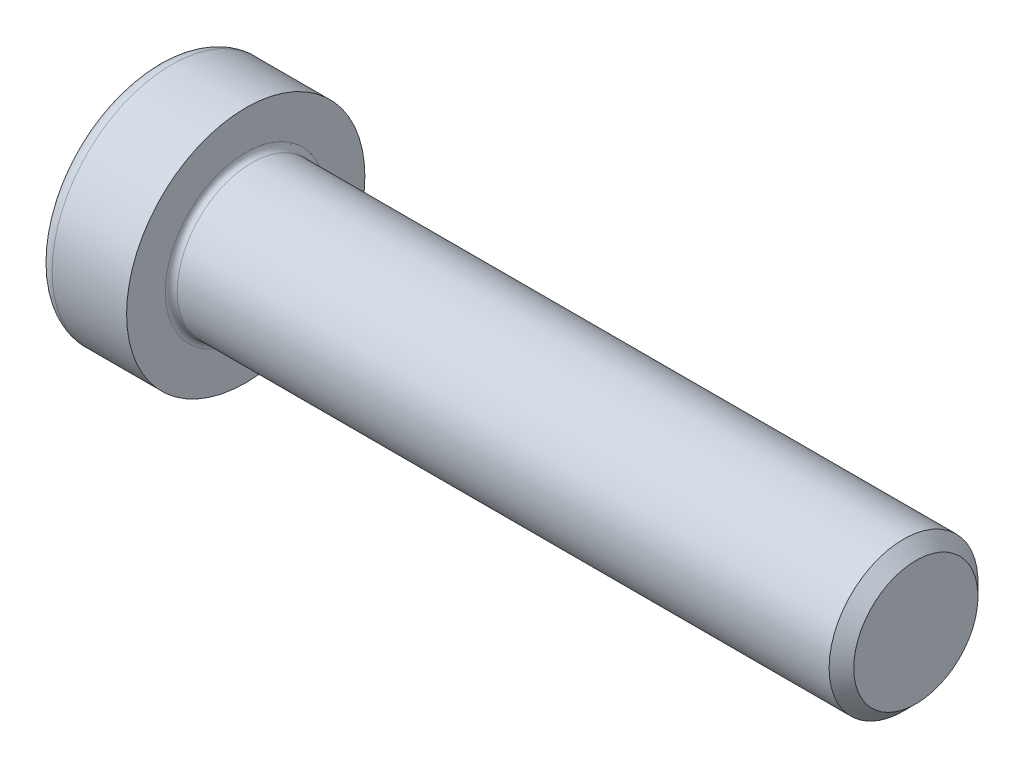
from build123d import *

# Parameters (mm, degrees)
FILLET1_R   = 0.4
FILLET2_R   = 1
HEX_2_DEPTH = 4.5


with BuildPart() as part:
    # BodySke → Base-Revolve (revolve)
    with BuildSketch(Plane.XY, mode=Mode.PRIVATE) as base_revolve_sk:
        Polygon((0, 0), (0, 8), (6, 8), (6, 5), (50.172, 5), (51, 4.172), (51, 0), align=None)
    revolve(base_revolve_sk.sketch.rotate(Axis((-31.75, 0, 0), (1, 0, 0)), 90), axis=Axis((-31.75, 0, 0), (1, 0, 0)))

    # Fillet1
    fillet1_edges = [part.edges().sort_by_distance(p)[0] for p in [
        (6, 0, -5),
    ]]
    fillet(fillet1_edges, radius=FILLET1_R)

    # Fillet2
    fillet2_edges = [part.edges().sort_by_distance(p)[0] for p in [
        (0, 0, -8),
    ]]
    fillet(fillet2_edges, radius=FILLET2_R)

    # Sketch2 → Hex-PreBroach (revolve, cut)
    with BuildSketch(Plane.XY, mode=Mode.PRIVATE) as hex_prebroach_sk:
        Polygon((0, 3.5), (4.5, 3.5), (6.520725942, 0), (0, 0), align=None)
    revolve(hex_prebroach_sk.sketch.rotate(Axis((0, 0, 0), (1, 0, 0)), 90), axis=Axis((0, 0, 0), (1, 0, 0)), mode=Mode.SUBTRACT)

    # Sketch3 → Hex 2 (cut)
    with BuildSketch(Plane(origin=(0, 0, 0), x_dir=(0, 0.500000000000001, 0.866025403784438), z_dir=(-1, 0, 0))):
        Polygon((2.020725942, 3.5), (-2.020725942, 3.5), (-4.041451884, 0), (-2.020725942, -3.5), (2.020725942, -3.5), (4.041451884, 0), align=None)
    extrude(amount=-HEX_2_DEPTH, mode=Mode.SUBTRACT)


solid = part.part
